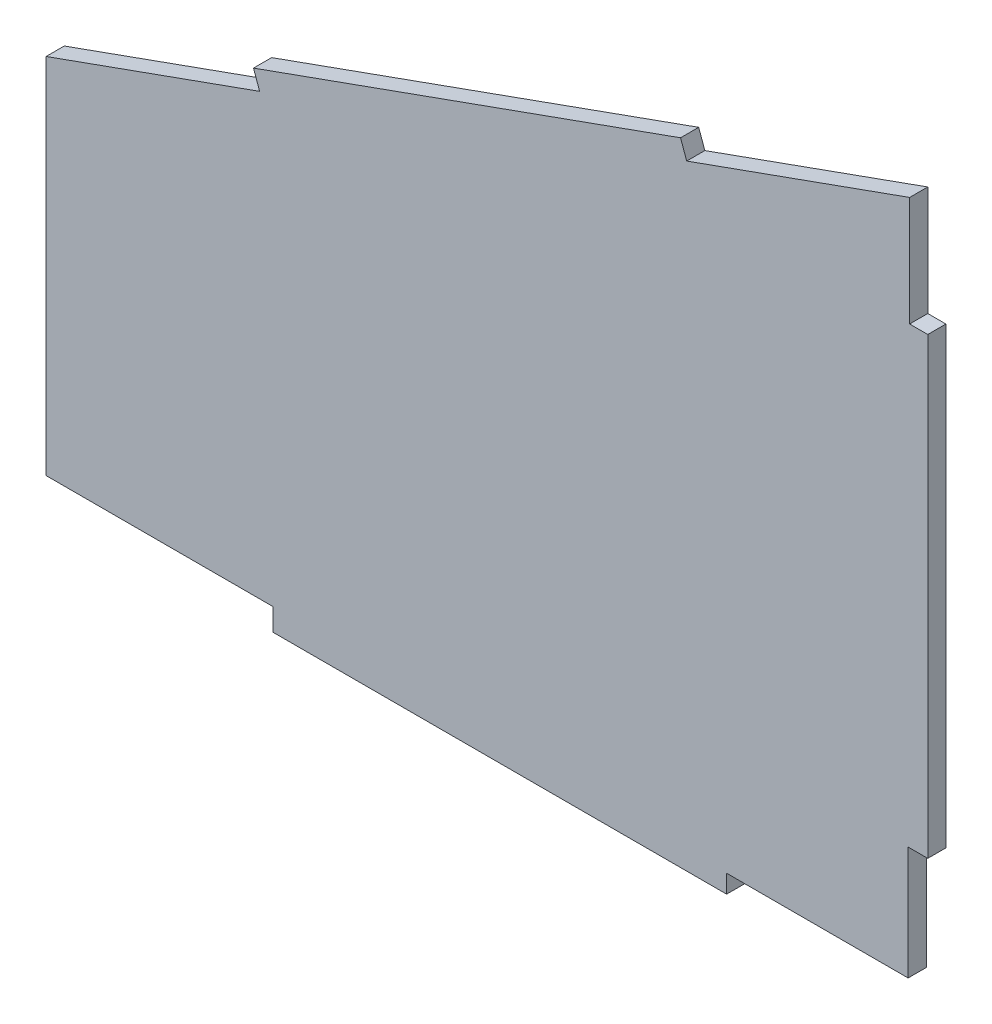
from build123d import *

# Parameters (mm, degrees)
EXTRUDE_1_DEPTH = 2


with BuildPart() as part:
    # 草图2 → 凸台-拉伸1 (new body)
    with BuildSketch(Plane.XY):
        Polygon((30.22420133, 24.680203113), (30.22420133, 36.760203113), (5.656415061, 27.949194211), (4.981241965, 29.831783197), (-42.083482687, 12.952455799), (-41.408309591, 11.069866813), (-64.940671917, 2.630203113), (-64.940671917, -37.369796887), (-39.940671917, -37.369796887), (-39.940671917, -39.819796887), (10.059328083, -39.819796887), (10.059328083, -37.819796887), (30.059328083, -37.819796887), (30.059328083, -25.319796887), (32.22420133, -25.319796887), (32.22420133, 24.680203113), align=None)
    extrude(amount=EXTRUDE_1_DEPTH)


solid = part.part
